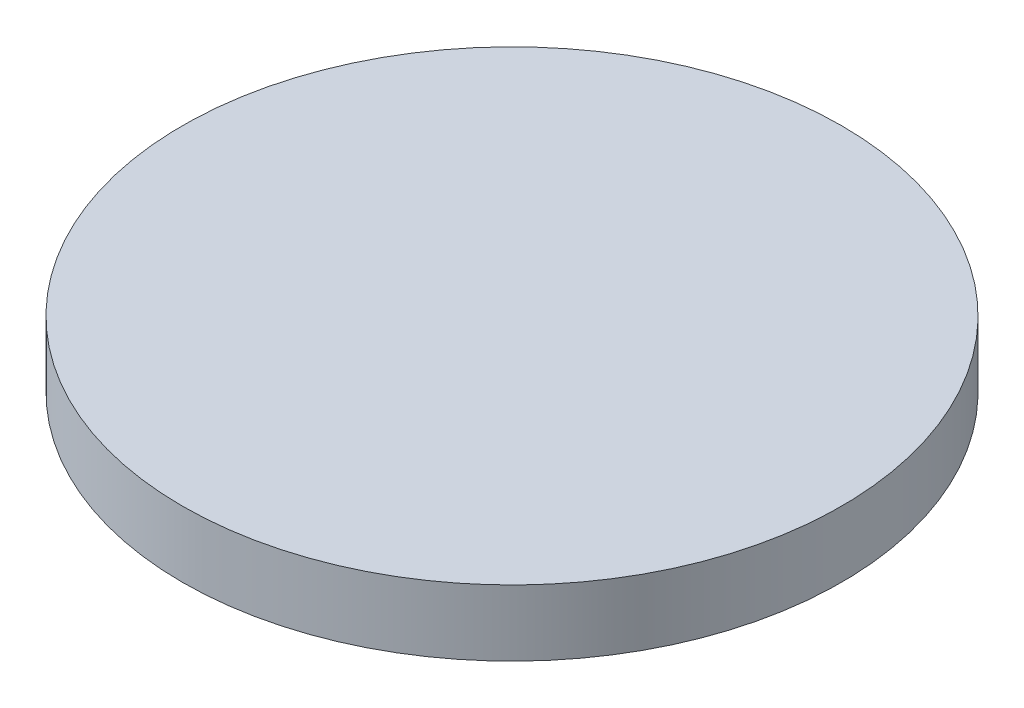
from build123d import *

# Parameters (mm, degrees)
SKETCH1_W = 9.906
SKETCH1_H = 1.98374


with BuildPart() as part:
    # Sketch1 → Revolve1 (revolve)
    with BuildSketch(Plane.XY, mode=Mode.PRIVATE) as revolve1_sk:
        with Locations((4.953, 0.99187)):
            Rectangle(SKETCH1_W, SKETCH1_H)
    revolve(revolve1_sk.sketch.rotate(Axis((0, 1.98374, 0), (0, -1, 0)), 270), axis=Axis((0, 1.98374, 0), (0, -1, 0)))


solid = part.part
